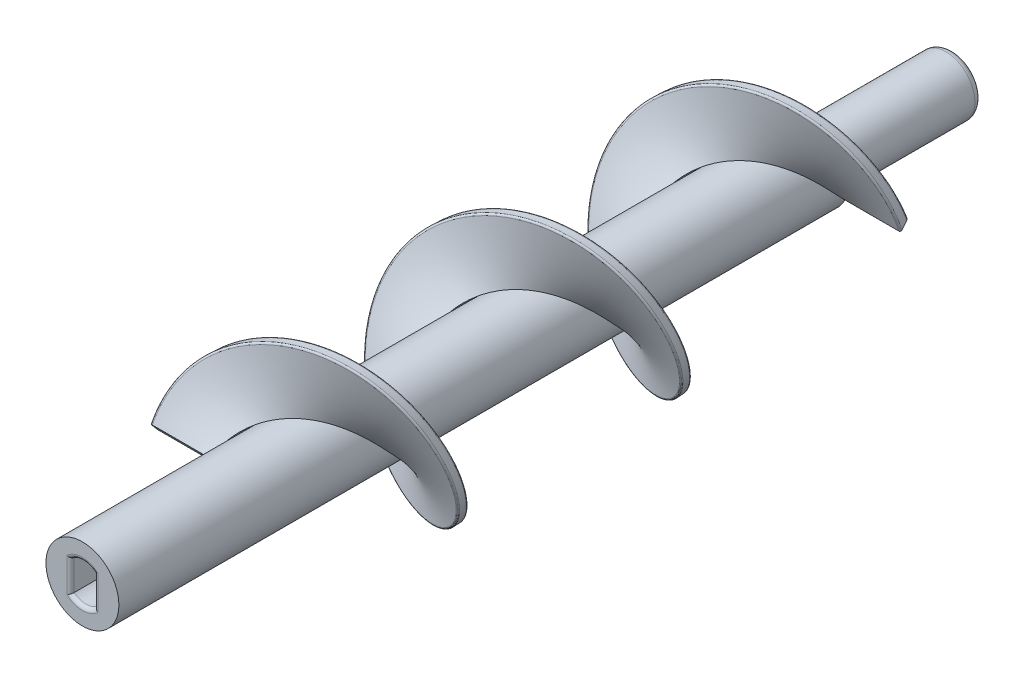
from build123d import *

# Parameters (mm, degrees)
SKETCH2_R           = 4.9
BOSS_EXTRUDE1_DEPTH = 49
SWEEP1_PITCH        = 30
SWEEP1_HEIGHT       = 75
SWEEP1_RADIUS       = 4
SKETCH6_W           = 3.2
SKETCH6_H           = 4.098780306
CUT_EXTRUDE1_DEPTH  = 9
SKETCH7_R           = 3.9
BOSS_EXTRUDE3_DEPTH = 19
FILLET1_R           = 1
FILLET2_R           = 0.5


with BuildPart() as part:
    # Sketch2 → Boss-Extrude1 (new, symmetric)
    with BuildSketch(Plane.XY):
        Circle(SKETCH2_R)
    extrude(amount=BOSS_EXTRUDE1_DEPTH, both=True)

    # Sketch6 → Cut-Extrude1 (cut)
    with BuildSketch(Plane.XY.offset(49)):
        with BuildLine():
            ThreePointArc((1.6, 2.049390153), (0, 2.6), (-1.6, 2.049390153))
            Line((-1.6, 2.049390153), (1.6, 2.049390153))
        make_face()
        Rectangle(SKETCH6_W, SKETCH6_H)
        with BuildLine():
            Line((1.6, -2.049390153), (-1.6, -2.049390153))
            ThreePointArc((-1.6, -2.049390153), (0, -2.6), (1.6, -2.049390153))
        make_face()
    extrude(amount=-CUT_EXTRUDE1_DEPTH, mode=Mode.SUBTRACT)

    # Sketch7 → Boss-Extrude3 (add)
    with BuildSketch(Plane(origin=(0, 0, -49), x_dir=(-1, 0, 0), z_dir=(0, 0, -1))):
        Circle(SKETCH7_R)
    extrude(amount=BOSS_EXTRUDE3_DEPTH)

    # Fillet1
    fillet1_edges = [part.edges().sort_by_distance(p)[0] for p in [
        (3.9, 0, -68),
    ]]
    fillet(fillet1_edges, radius=FILLET1_R)

    # Fillet2
    fillet2_edges = [part.edges().sort_by_distance(p)[0] for p in [
        (0, 2.6, 49),
        (0, -2.6, 49),
        (1.6, 0, 49),
        (-1.6, 0, 49),
    ]]
    fillet(fillet2_edges, radius=FILLET2_R)


with BuildPart() as body_2:
    # Sweep1: sweep along a helix
    with BuildLine() as sweep1_path:
        Helix(SWEEP1_PITCH, SWEEP1_HEIGHT, SWEEP1_RADIUS, center=(0, 0, -49), direction=(0, 0, 1))
    # Sketch5 → Sweep1 (sweep)
    with BuildSketch(Plane(origin=(4, 0, -49), x_dir=(1, 0, 0), z_dir=(4.26647316558728e-15, 0.6421839222196329, 0.7665505919654675))):
        with BuildLine():
            Line((0.9, 0), (8.65, 0))
            ThreePointArc((8.65, 0), (8.826776695, -0.073223305), (8.9, -0.25))
            Line((8.9, -0.25), (8.9, -1.25))
            ThreePointArc((8.9, -1.25), (8.826776695, -1.426776695), (8.65, -1.5))
            Line((8.65, -1.5), (0.9, -1.5))
            Line((0.9, -1.5), (0.9, 0))
        make_face()
    sweep(path=sweep1_path.line, is_frenet=True)


solid = Compound([part.part, body_2.part])
